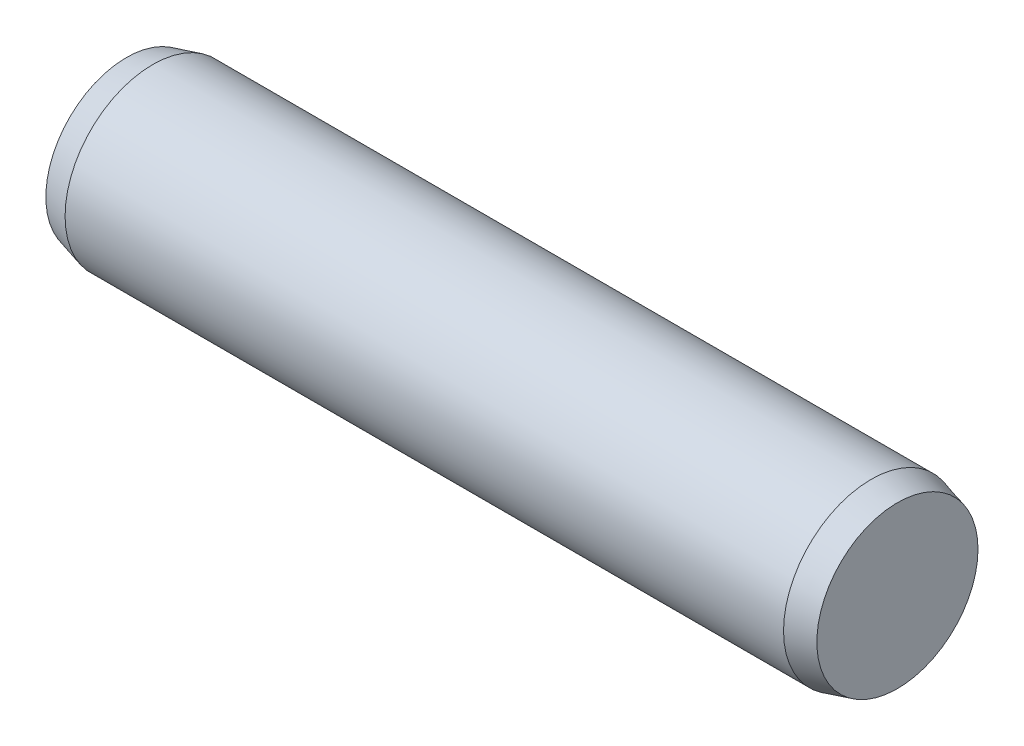
from build123d import *

# Parameters (mm, degrees)
SKETCH1_R           = 2.5
BOSS_EXTRUDE1_DEPTH = 11
CHAMFER1_SIZE       = 0.75
CHAMFER1_SIZE2      = 0.200961894


with BuildPart() as part:
    # Sketch1 → Boss-Extrude1 (new, symmetric)
    with BuildSketch(Plane(origin=(0, 0, 0), x_dir=(0, 0, -1), z_dir=(1, 0, 0))):
        Circle(SKETCH1_R)
    extrude(amount=BOSS_EXTRUDE1_DEPTH, both=True)

    # Chamfer1
    chamfer1_edges = [part.edges().sort_by_distance(p)[0] for p in [
        (-11, 0, 2.5),
        (11, 0, 2.5),
    ]]
    chamfer1_side = [part.faces().sort_by_distance(p)[0] for p in [
        (0, 0, 2.5),
    ]]
    chamfer(chamfer1_edges, length=CHAMFER1_SIZE, length2=CHAMFER1_SIZE2, reference=chamfer1_side[0])


solid = part.part
